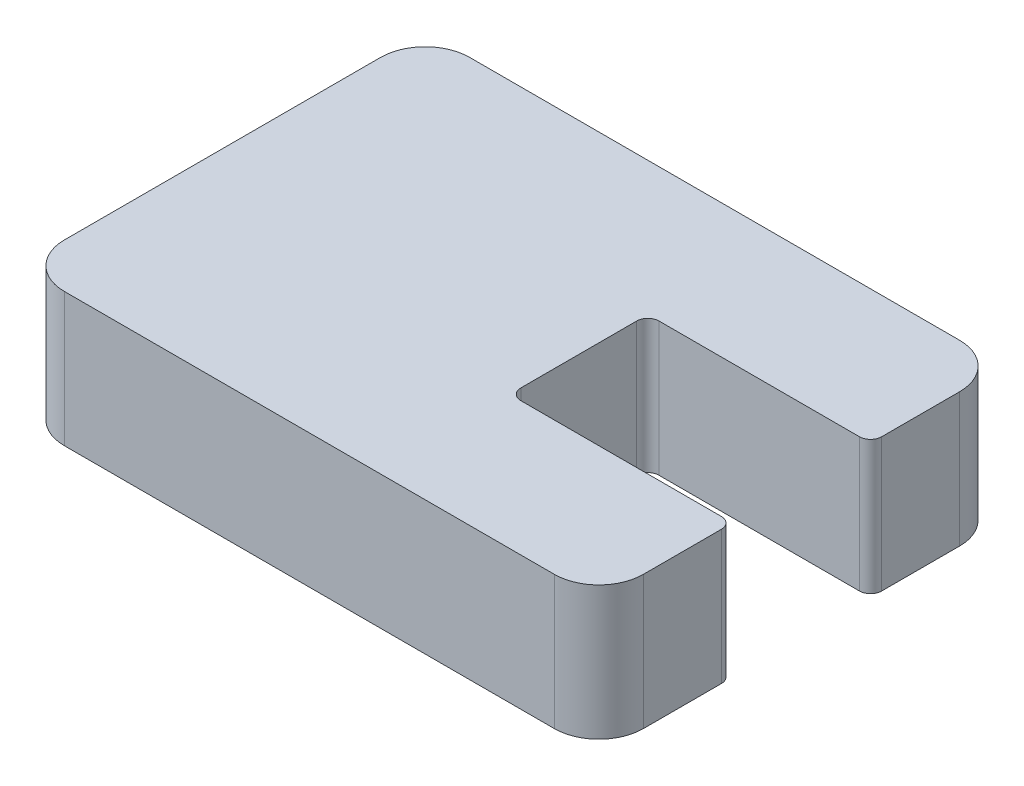
from build123d import *

# Parameters (mm, degrees)
SALIENTE_EXTRUIR1_DEPTH = 3
REDONDEO1_R             = 0.25


with BuildPart() as part:
    # Croquis1 → Saliente-Extruir1 (new body)
    with BuildSketch(Plane(origin=(0, 0, 0), x_dir=(1, 0, 0), z_dir=(0, 1, 0))):
        with BuildLine():
            Line((0, 3.55), (0, -3.55))
            ThreePointArc((0, -3.55), (0.292893219, -4.257106781), (1, -4.55))
            Line((1, -4.55), (12, -4.55))
            ThreePointArc((12, -4.55), (12.707106781, -4.257106781), (13, -3.55))
            Line((13, -3.55), (13, -1.55))
            Line((13, -1.55), (8, -1.55))
            Line((8, -1.55), (8, 1.55))
            Line((8, 1.55), (13, 1.55))
            Line((13, 1.55), (13, 3.55))
            ThreePointArc((13, 3.55), (12.707106781, 4.257106781), (12, 4.55))
            Line((12, 4.55), (1, 4.55))
            ThreePointArc((1, 4.55), (0.292893219, 4.257106781), (0, 3.55))
        make_face()
    extrude(amount=SALIENTE_EXTRUIR1_DEPTH)

    # Redondeo1
    redondeo1_edges = [part.edges().sort_by_distance(p)[0] for p in [
        (13, 1.5, -1.55),
        (8, 1.5, -1.55),
        (8, 1.5, 1.55),
        (13, 1.5, 1.55),
    ]]
    fillet(redondeo1_edges, radius=REDONDEO1_R)


solid = part.part
